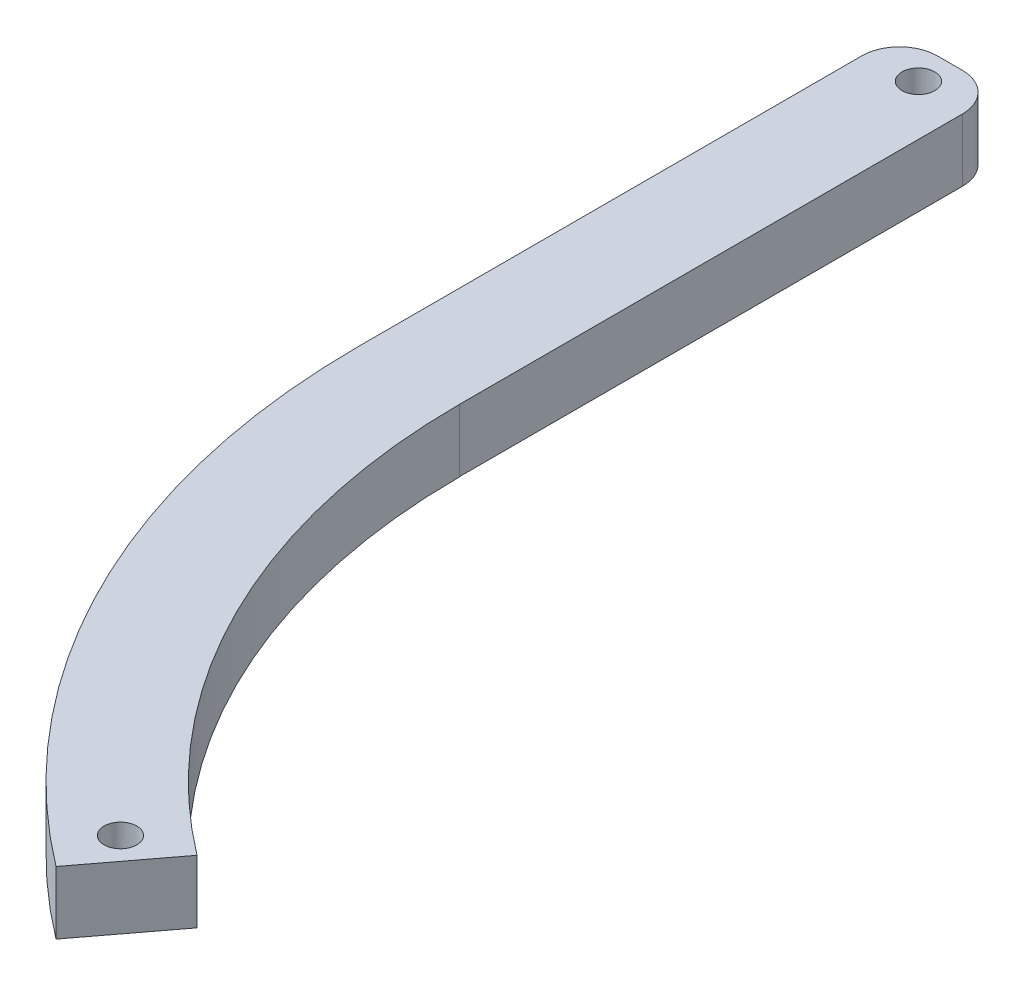
from build123d import *

# Parameters (mm, degrees)
BOSS_EXTRUDE1_DEPTH = 6.35
SKETCH2_W           = 10.16
SKETCH2_H           = 6.326695662
BOSS_EXTRUDE2_DEPTH = 54.61
SKETCH3_R           = 1.651
CUT_EXTRUDE1_DEPTH  = 6.35
SKETCH4_R           = 1.651
CUT_EXTRUDE2_DEPTH  = 22.606
FILLET1_R           = 3.81


with BuildPart() as part:
    # Sketch1 → Boss-Extrude1 (new body)
    with BuildSketch(Plane(origin=(0, 0, 0), x_dir=(1, 0, 0), z_dir=(0, 1, 0))):
        with BuildLine():
            Line((-66.04, 0), (-76.2, 0))
            ThreePointArc((-76.2, 0), (-68.233584612, -33.920759587), (-46.000054305, -60.748950641))
            Line((-46.000054305, -60.748950641), (-39.866713731, -52.649090555))
            ThreePointArc((-39.866713731, -52.649090555), (-59.135773331, -29.397991642), (-66.04, 0))
        make_face()
    extrude(amount=BOSS_EXTRUDE1_DEPTH)

    # Sketch2 → Boss-Extrude2 (add)
    with BuildSketch(Plane(origin=(0, 0, 0), x_dir=(-1, 0, 0), z_dir=(0, 0, -1))):
        with Locations((71.12, 3.186652169)):
            Rectangle(SKETCH2_W, SKETCH2_H)
    extrude(amount=BOSS_EXTRUDE2_DEPTH)

    # Sketch3 → Cut-Extrude1 (cut)
    with BuildSketch(Plane(origin=(0, 6.35, 0), x_dir=(1, 0, 0), z_dir=(0, 1, 0))):
        with Locations(Location((-71.12, 51.435, 0), (0, 0, 270))):
            Circle(SKETCH3_R)
    extrude(amount=-CUT_EXTRUDE1_DEPTH, mode=Mode.SUBTRACT)

    # Sketch4 → Cut-Extrude2 (cut)
    with BuildSketch(Plane(origin=(0, 6.35, 0), x_dir=(1, 0, 0), z_dir=(0, 1, 0))):
        with Locations(Location((-45.464590295, -54.782351668, 0), (0, 0, 270))):
            Circle(SKETCH4_R)
    extrude(amount=-CUT_EXTRUDE2_DEPTH, mode=Mode.SUBTRACT)

    # Fillet1
    fillet1_edges = [part.edges().sort_by_distance(p)[0] for p in [
        (-66.04, 3.186652169, -54.61),
        (-76.2, 3.186652169, -54.61),
    ]]
    fillet(fillet1_edges, radius=FILLET1_R)


solid = part.part
